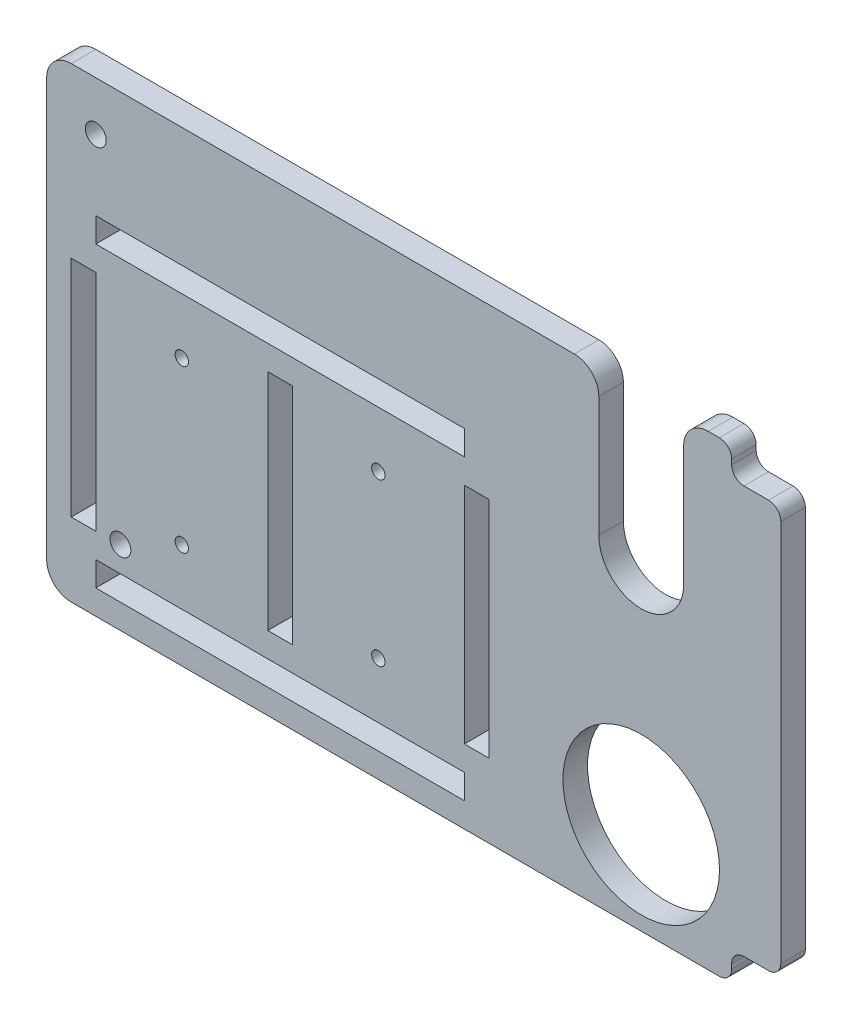
from build123d import *
from OCP.BRepFilletAPI import BRepFilletAPI_MakeFillet

# Parameters (mm, degrees)
SKETCH1_R                   = 20.2311
BOSS_EXTRUDE1_DEPTH         = 6.35
FILLET1_R1                  = 6.35
FILLET1_R2                  = 3.175
TAP_DRILL_FOR_8_32_TAP3_D   = 3.4544
TAP_DRILL_FOR_1_4_28_TAP1_D = 5.4102
SKETCH13_W                  = 95.25
SKETCH13_H                  = 6.35
SKETCH13_W_2                = 6.35
SKETCH13_H_2                = 57.927875
CUT_EXTRUDE1_DEPTH          = 136.524699219


with BuildPart() as part:
    # Sketch1 → Boss-Extrude1 (new body)
    with BuildSketch(Plane.XY):
        with BuildLine():
            Line((-114.3, 72.540551407), (28.4099, 72.540551407))
            Line((28.4099, 72.540551407), (28.4099, 35.1155))
            ThreePointArc((28.4099, 35.1155), (39.37, 24.1554), (50.3301, 35.1155))
            Line((50.3301, 35.1155), (50.3301, 72.540551407))
            Line((50.3301, 72.540551407), (62.738, 72.540551407))
            Line((62.738, 72.540551407), (62.738, 64.920551407))
            Line((62.738, 64.920551407), (75.438, 64.920551407))
            Line((75.438, 64.920551407), (75.438, -40.3939375))
            Line((75.438, -40.3939375), (62.738, -40.3939375))
            Line((62.738, -40.3939375), (62.738, -48.0139375))
            Line((62.738, -48.0139375), (-114.3, -48.0139375))
            Line((-114.3, -48.0139375), (-114.3, 72.540551407))
        make_face()
        with Locations((39.37, -24.152515463)):
            Circle(SKETCH1_R, mode=Mode.SUBTRACT)
    extrude(amount=BOSS_EXTRUDE1_DEPTH)

    # Fillet1: one fillet with a radius per group of edges: ONE call of the kernel's fillet builder (fillet() takes one radius for all edges)
    fillet1_edges_1 = [part.edges().sort_by_distance(p)[0] for p in [
        (50.3301, 72.540551407, 3.175),
        (28.4099, 72.540551407, 3.175),
        (-114.3, 72.540551407, 3.175),
        (-114.3, -48.0139375, 3.175),
    ]]
    fillet1_edges_2 = [part.edges().sort_by_distance(p)[0] for p in [
        (62.738, 64.920551407, 3.175),
        (75.438, 64.920551407, 3.175),
        (62.738, 72.540551407, 3.175),
        (62.738, -48.0139375, 3.175),
        (62.738, -40.3939375, 3.175),
        (75.438, -40.3939375, 3.175),
    ]]
    fillet1 = BRepFilletAPI_MakeFillet(part.part.solid().wrapped)
    for e in fillet1_edges_1:
        fillet1.Add(FILLET1_R1, e.wrapped)
    for e in fillet1_edges_2:
        fillet1.Add(FILLET1_R2, e.wrapped)
    add(Compound.cast(fillet1.Shape()), mode=Mode.REPLACE)

    # Tap Drill for #8-32 Tap3 (through all)
    with Locations(Plane(origin=(-189.82086846, 75.287041891, 6.35), x_dir=(0, -1, 0), z_dir=(0, 0, 1))):
        with Locations((54.400304391, 110.44586846), (96.173779391, 110.44586846), (96.173779391, 161.24586846), (54.400304391, 161.24586846)):
            Hole(TAP_DRILL_FOR_8_32_TAP3_D / 2)

    # Tap Drill for 1/4-28 Tap1 (through all)
    with Locations(Plane(origin=(-189.82086846, 75.287041891, 6.35), x_dir=(0, 1, 0), z_dir=(0, 0, 1))):
        with Locations((-15.446490484, -88.22086846), (-104.052541891, -94.57086846)):
            Hole(TAP_DRILL_FOR_1_4_28_TAP1_D / 2)

    # Sketch13 → Cut-Extrude1 (cut, through all)
    with BuildSketch(Plane.XY.offset(6.35)):
        with Locations((-53.975, -38.4889375)):
            Rectangle(SKETCH13_W, SKETCH13_H)
        with Locations((-53.975, 0)):
            Rectangle(SKETCH13_W_2, SKETCH13_H_2)
        with Locations((-3.175, 0)):
            Rectangle(SKETCH13_W_2, SKETCH13_H_2)
        with Locations((-53.975, 38.4889375)):
            Rectangle(SKETCH13_W, SKETCH13_H)
        with Locations((-104.775, 0)):
            Rectangle(SKETCH13_W_2, SKETCH13_H_2)
    extrude(amount=-CUT_EXTRUDE1_DEPTH, mode=Mode.SUBTRACT)


solid = part.part
